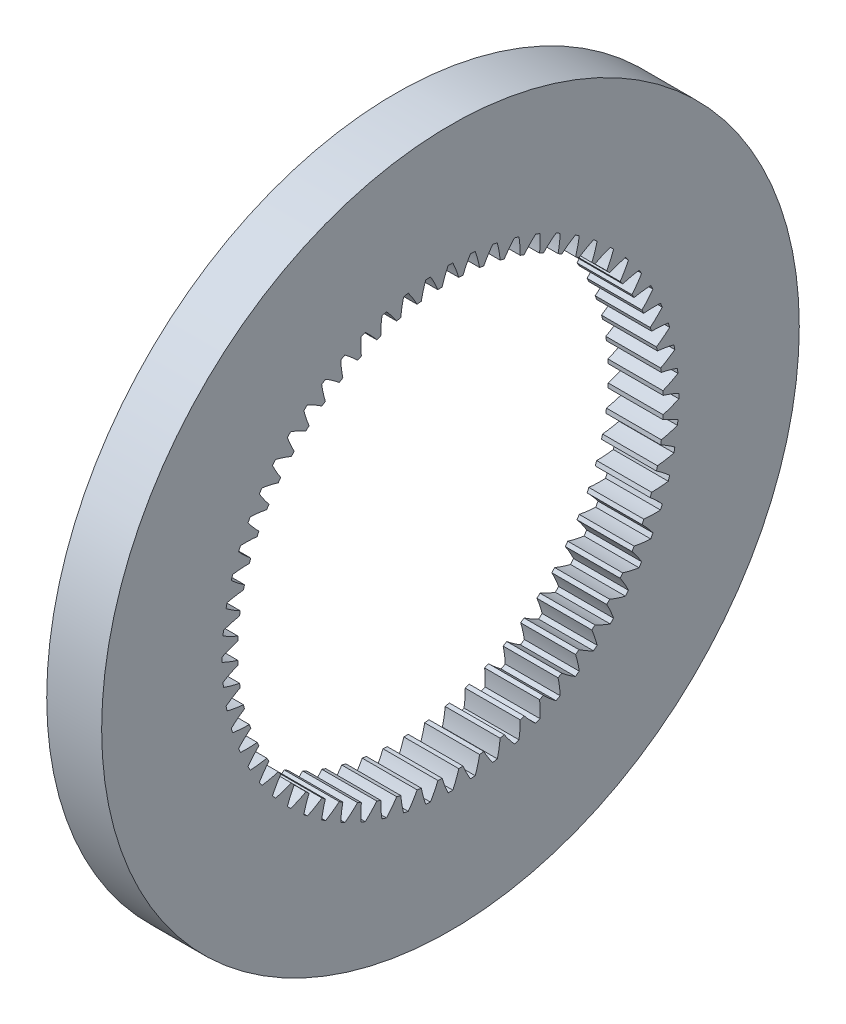
from build123d import *

# Parameters (mm, degrees)
BASPROSKE_W         = 20
BASPROSKE_H         = 11.25
TOOTHCUT_DEPTH      = 74.484692283
TEETHCUTS_COUNT     = 64
TEETHCUTS_ANGLE     = 354.375
SKETCH1_R           = 63.5
SKETCH1_R_2         = 50
BOSS_EXTRUDE1_DEPTH = 10
SKETCH3_R           = 63.5
CUT_EXTRUDE2_DEPTH  = 20


with BuildPart() as part:
    # BasProSke → Base-Revolve (revolve)
    with BuildSketch(Plane(origin=(0, 0, 0), x_dir=(1, 0, 0), z_dir=(0, 1, 0)), mode=Mode.PRIVATE) as base_revolve_sk:
        with Locations((10, 44.375)):
            Rectangle(BASPROSKE_W, BASPROSKE_H)
    revolve(base_revolve_sk.sketch.rotate(Axis((-10, 0, 0), (1, 0, 0)), 180), axis=Axis((-10, 0, 0), (1, 0, 0)))

    # TooCutSke → ToothCut (cut, through all)
    with BuildSketch(Plane(origin=(0, 0, 0), x_dir=(0, 0, -1), z_dir=(1, 0, 0))):
        with BuildLine():
            ThreePointArc((1.525533208, 38.694539584), (1.032249126, 40.148983793), (0.428813725, 41.56128789))
            ThreePointArc((0.428813725, 41.56128789), (0, 41.5635), (-0.428813725, 41.56128789))
            ThreePointArc((-0.428813725, 41.56128789), (-1.032249126, 40.148983793), (-1.525533208, 38.694539584))
            ThreePointArc((-1.525533208, 38.694539584), (0, 38.7246), (1.525533208, 38.694539584))
        make_face()
    toothcut = extrude(amount=TOOTHCUT_DEPTH, mode=Mode.SUBTRACT)

    # TeethCuts: ToothCut ×64 about axis
    teethcuts_axis = Axis((-10, 0, 0), (1, 0, 0))
    for i in range(1, TEETHCUTS_COUNT):
        add(toothcut.rotate(teethcuts_axis, i * TEETHCUTS_ANGLE / (TEETHCUTS_COUNT - 1)), mode=Mode.SUBTRACT)

    # Sketch1 → Boss-Extrude1 (add)
    with BuildSketch(Plane(origin=(20, 0, 0), x_dir=(0, 0, -1), z_dir=(1, 0, 0))):
        Circle(SKETCH1_R)
        with Locations(Location((0, 0, 0), (0, 0, 180))):
            Circle(SKETCH1_R_2, mode=Mode.SUBTRACT)
    extrude(amount=-BOSS_EXTRUDE1_DEPTH)

    # Sketch3 → Cut-Extrude2 (cut)
    with BuildSketch(Plane.ZY.offset(-10)):
        with Locations(Location((0, 0, 0), (0, 0, 180))):
            Circle(SKETCH3_R)
    extrude(amount=CUT_EXTRUDE2_DEPTH, mode=Mode.SUBTRACT)


solid = part.part
